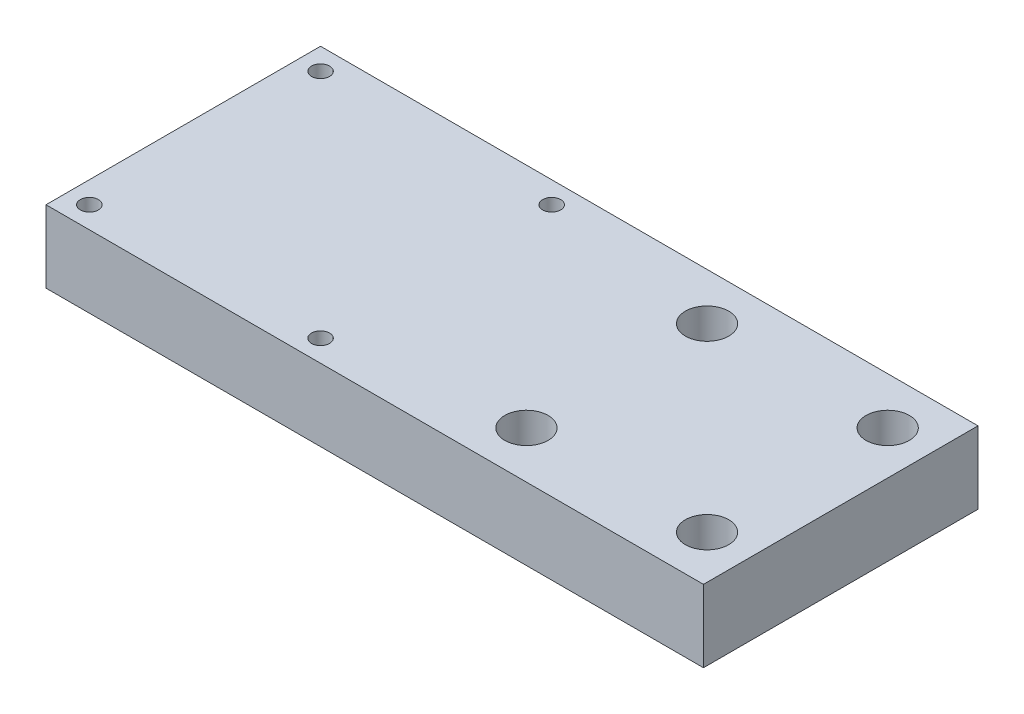
from build123d import *

# Parameters (mm, degrees)
SKETCH1_W             = 91
SKETCH1_H             = 38
SKETCH1_R             = 3
BOSS_EXTRUDE1_DEPTH   = 10
M3X0_5_TAPPED_HOLE1_D = 2.5


with BuildPart() as part:
    # Sketch1 → Boss-Extrude1 (new body)
    with BuildSketch(Plane(origin=(0, 0, 0), x_dir=(1, 0, 0), z_dir=(0, 1, 0))):
        with Locations((26.530497816, -16.359463259)):
            Rectangle(SKETCH1_W, SKETCH1_H)
        with Locations(Location((41.030497816, -28.859463259, 0), (0, 0, 270))):
            Circle(SKETCH1_R, mode=Mode.SUBTRACT)
        with Locations(Location((66.030497816, -28.859463259, 0), (0, 0, 270))):
            Circle(SKETCH1_R, mode=Mode.SUBTRACT)
        with Locations(Location((41.030497816, -3.859463259, 0), (0, 0, 270))):
            Circle(SKETCH1_R, mode=Mode.SUBTRACT)
        with Locations(Location((66.030497816, -3.859463259, 0), (0, 0, 270))):
            Circle(SKETCH1_R, mode=Mode.SUBTRACT)
    extrude(amount=BOSS_EXTRUDE1_DEPTH)

    # M3x0.5 Tapped Hole1 (through all)
    with Locations(Plane(origin=(0, 0, 0), x_dir=(-1, 0, 0), z_dir=(0, -1, 0))):
        with Locations((-16.030497816, -0.359463259), (15.969502184, -32.359463259), (-16.030497816, -32.359463259), (15.969502184, -0.359463259)):
            Hole(M3X0_5_TAPPED_HOLE1_D / 2)


solid = part.part
